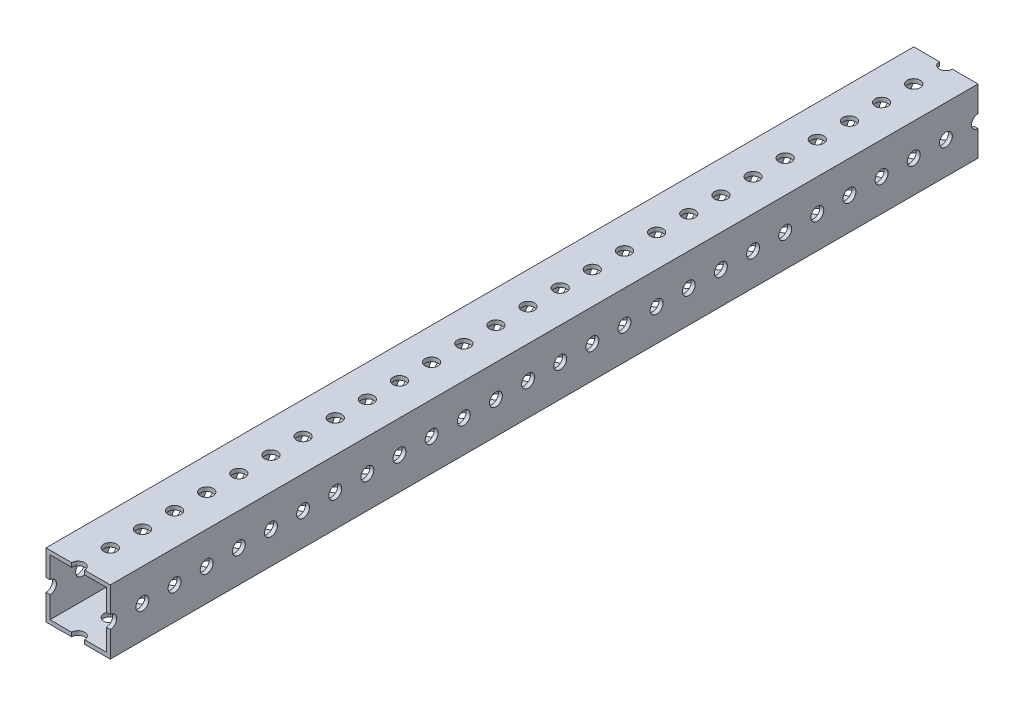
from build123d import *

# Parameters (mm, degrees)
SKETCH1_W           = 25.4
SKETCH1_H           = 25.4
SKETCH1_W_2         = 22.225
SKETCH1_H_2         = 22.225
BOSS_EXTRUDE1_DEPTH = 342.9
SKETCH2_R           = 2.5527
CUT_EXTRUDE1_DEPTH  = 345.073916477
SKETCH3_R           = 2.5527
CUT_EXTRUDE2_DEPTH  = 345.073916477


with BuildPart() as part:
    # Sketch1 → Boss-Extrude1 (new body)
    with BuildSketch(Plane.XY):
        Rectangle(SKETCH1_W, SKETCH1_H)
        Rectangle(SKETCH1_W_2, SKETCH1_H_2, mode=Mode.SUBTRACT)
    extrude(amount=BOSS_EXTRUDE1_DEPTH)

    # Sketch2 → Cut-Extrude1 (cut, through all)
    with BuildSketch(Plane(origin=(0, 12.7, 0), x_dir=(1, 0, 0), z_dir=(0, 1, 0))):
        Circle(SKETCH2_R)
        with Locations(Location((0, -12.7, 0), (0, 0, 270))):
            Circle(SKETCH2_R)
        with Locations(Location((0, -25.4, 0), (0, 0, 270))):
            Circle(SKETCH2_R)
        with Locations(Location((0, -38.1, 0), (0, 0, 270))):
            Circle(SKETCH2_R)
        with Locations(Location((0, -50.8, 0), (0, 0, 270))):
            Circle(SKETCH2_R)
        with Locations(Location((0, -63.5, 0), (0, 0, 270))):
            Circle(SKETCH2_R)
        with Locations(Location((0, -76.2, 0), (0, 0, 270))):
            Circle(SKETCH2_R)
        with Locations(Location((0, -88.9, 0), (0, 0, 270))):
            Circle(SKETCH2_R)
        with Locations(Location((0, -101.6, 0), (0, 0, 270))):
            Circle(SKETCH2_R)
        with Locations(Location((0, -114.3, 0), (0, 0, 270))):
            Circle(SKETCH2_R)
        with Locations(Location((0, -127, 0), (0, 0, 270))):
            Circle(SKETCH2_R)
        with Locations(Location((0, -139.7, 0), (0, 0, 270))):
            Circle(SKETCH2_R)
        with Locations(Location((0, -152.4, 0), (0, 0, 270))):
            Circle(SKETCH2_R)
        with Locations(Location((0, -165.1, 0), (0, 0, 270))):
            Circle(SKETCH2_R)
        with Locations(Location((0, -177.8, 0), (0, 0, 270))):
            Circle(SKETCH2_R)
        with Locations(Location((0, -190.5, 0), (0, 0, 270))):
            Circle(SKETCH2_R)
        with Locations(Location((0, -203.2, 0), (0, 0, 270))):
            Circle(SKETCH2_R)
        with Locations(Location((0, -215.9, 0), (0, 0, 270))):
            Circle(SKETCH2_R)
        with Locations(Location((0, -228.6, 0), (0, 0, 270))):
            Circle(SKETCH2_R)
        with Locations(Location((0, -241.3, 0), (0, 0, 270))):
            Circle(SKETCH2_R)
        with Locations(Location((0, -254, 0), (0, 0, 270))):
            Circle(SKETCH2_R)
        with Locations(Location((0, -266.7, 0), (0, 0, 270))):
            Circle(SKETCH2_R)
        with Locations(Location((0, -279.4, 0), (0, 0, 270))):
            Circle(SKETCH2_R)
        with Locations(Location((0, -292.1, 0), (0, 0, 270))):
            Circle(SKETCH2_R)
        with Locations(Location((0, -304.8, 0), (0, 0, 270))):
            Circle(SKETCH2_R)
        with Locations(Location((0, -317.5, 0), (0, 0, 270))):
            Circle(SKETCH2_R)
        with Locations(Location((0, -330.2, 0), (0, 0, 270))):
            Circle(SKETCH2_R)
        with Locations((0, -342.9)):
            Circle(SKETCH2_R)
        with Locations((0, -355.6)):
            Circle(SKETCH2_R)
        with Locations((0, -368.3)):
            Circle(SKETCH2_R)
    extrude(amount=-CUT_EXTRUDE1_DEPTH, mode=Mode.SUBTRACT)

    # Sketch3 → Cut-Extrude2 (cut, through all)
    with BuildSketch(Plane(origin=(12.7, 0, 0), x_dir=(0, 0, -1), z_dir=(1, 0, 0))):
        Circle(SKETCH3_R)
        with Locations(Location((-12.7, 0, 0), (0, 0, 90))):
            Circle(SKETCH3_R)
        with Locations(Location((-25.4, 0, 0), (0, 0, 90))):
            Circle(SKETCH3_R)
        with Locations(Location((-38.1, 0, 0), (0, 0, 90))):
            Circle(SKETCH3_R)
        with Locations(Location((-50.8, 0, 0), (0, 0, 90))):
            Circle(SKETCH3_R)
        with Locations(Location((-63.5, 0, 0), (0, 0, 90))):
            Circle(SKETCH3_R)
        with Locations(Location((-76.2, 0, 0), (0, 0, 90))):
            Circle(SKETCH3_R)
        with Locations(Location((-88.9, 0, 0), (0, 0, 90))):
            Circle(SKETCH3_R)
        with Locations(Location((-101.6, 0, 0), (0, 0, 90))):
            Circle(SKETCH3_R)
        with Locations(Location((-114.3, 0, 0), (0, 0, 90))):
            Circle(SKETCH3_R)
        with Locations(Location((-127, 0, 0), (0, 0, 90))):
            Circle(SKETCH3_R)
        with Locations(Location((-139.7, 0, 0), (0, 0, 90))):
            Circle(SKETCH3_R)
        with Locations(Location((-152.4, 0, 0), (0, 0, 90))):
            Circle(SKETCH3_R)
        with Locations(Location((-165.1, 0, 0), (0, 0, 90))):
            Circle(SKETCH3_R)
        with Locations(Location((-177.8, 0, 0), (0, 0, 90))):
            Circle(SKETCH3_R)
        with Locations(Location((-190.5, 0, 0), (0, 0, 90))):
            Circle(SKETCH3_R)
        with Locations(Location((-203.2, 0, 0), (0, 0, 90))):
            Circle(SKETCH3_R)
        with Locations(Location((-215.9, 0, 0), (0, 0, 90))):
            Circle(SKETCH3_R)
        with Locations(Location((-228.6, 0, 0), (0, 0, 90))):
            Circle(SKETCH3_R)
        with Locations(Location((-241.3, 0, 0), (0, 0, 90))):
            Circle(SKETCH3_R)
        with Locations(Location((-254, 0, 0), (0, 0, 90))):
            Circle(SKETCH3_R)
        with Locations(Location((-266.7, 0, 0), (0, 0, 90))):
            Circle(SKETCH3_R)
        with Locations(Location((-279.4, 0, 0), (0, 0, 90))):
            Circle(SKETCH3_R)
        with Locations(Location((-292.1, 0, 0), (0, 0, 90))):
            Circle(SKETCH3_R)
        with Locations(Location((-304.8, 0, 0), (0, 0, 90))):
            Circle(SKETCH3_R)
        with Locations(Location((-317.5, 0, 0), (0, 0, 90))):
            Circle(SKETCH3_R)
        with Locations(Location((-330.2, 0, 0), (0, 0, 90))):
            Circle(SKETCH3_R)
        with Locations((-342.9, 0)):
            Circle(SKETCH3_R)
        with Locations((-355.6, 0)):
            Circle(SKETCH3_R)
        with Locations((-368.3, 0)):
            Circle(SKETCH3_R)
    extrude(amount=-CUT_EXTRUDE2_DEPTH, mode=Mode.SUBTRACT)


solid = part.part
